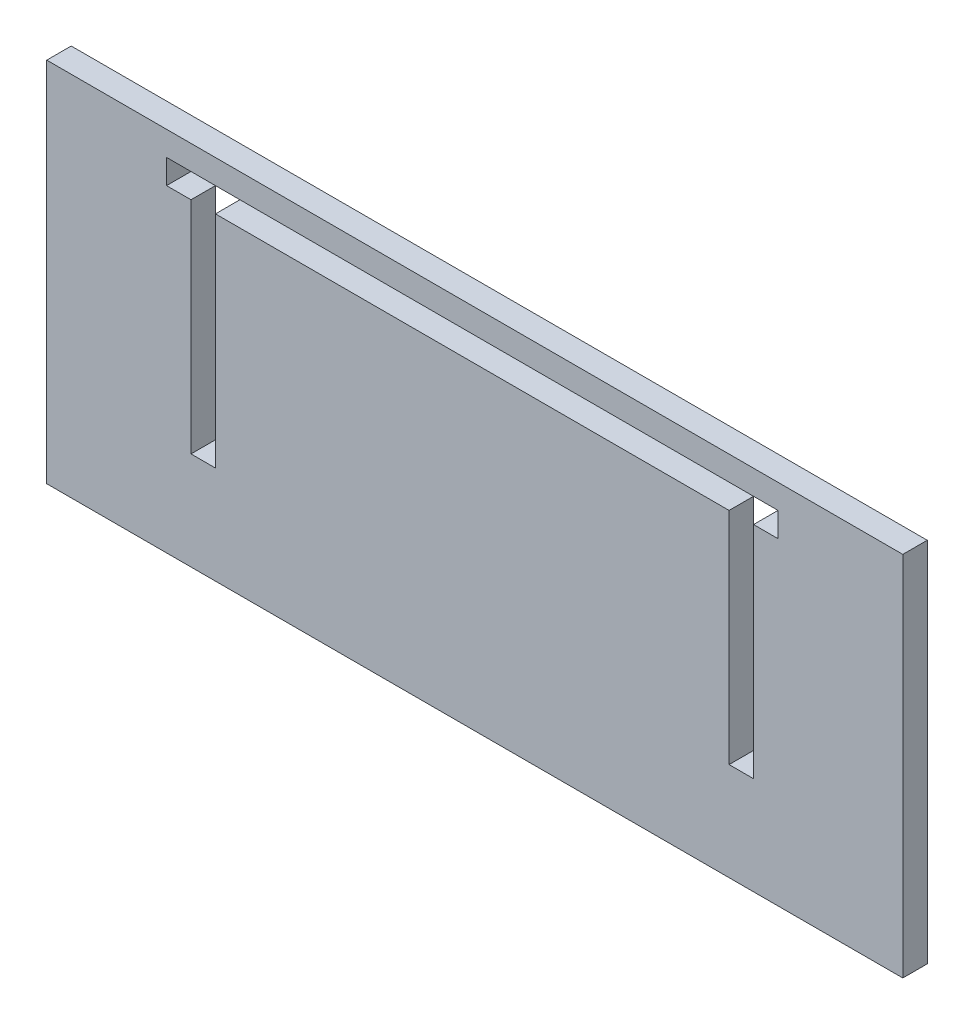
from build123d import *

# Parameters (mm, degrees)
ESQUISSE1_W        = 175
ESQUISSE1_H        = 75
BOSS_EXTRU_2_DEPTH = 5


with BuildPart() as part:
    # Esquisse1 → Boss.-Extru.2 (new body)
    with BuildSketch(Plane.XY):
        with Locations((9.63163738, -21.694161764)):
            Rectangle(ESQUISSE1_W, ESQUISSE1_H)
        Polygon((-53.378812272, 5.831962367), (-53.378812272, 10.831962367), (71.621187728, 10.831962367), (71.621187728, 5.831962367), (66.621187728, 5.831962367), (66.621187728, -39.168037633), (61.621187728, -39.168037633), (61.621187728, 5.831962367), (-43.378812272, 5.831962367), (-43.378812272, -39.168037633), (-48.378812272, -39.168037633), (-48.378812272, 5.831962367), align=None, mode=Mode.SUBTRACT)
    extrude(amount=BOSS_EXTRU_2_DEPTH)


solid = part.part
